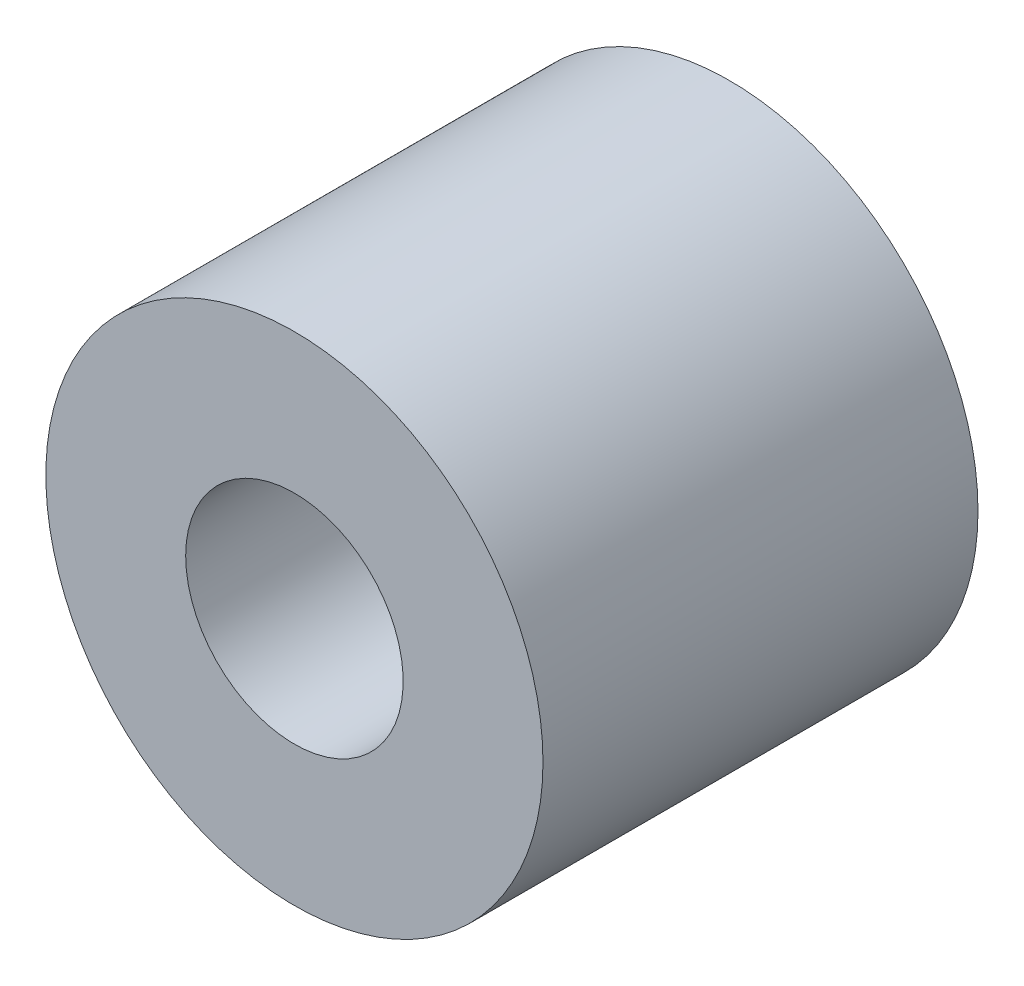
from build123d import *

# Parameters (mm, degrees)
ESBO_O1_R                = 4
RESSALTO_EXTRUS_O1_DEPTH = 7
ESBO_O2_R                = 1.75
CORTE_EXTRUS_O1_DEPTH    = 7


with BuildPart() as part:
    # Esboço1 → Ressalto-extrusão1 (new body)
    with BuildSketch(Plane.XY):
        Circle(ESBO_O1_R)
    extrude(amount=RESSALTO_EXTRUS_O1_DEPTH)

    # Esboço2 → Corte-extrusão1 (cut)
    with BuildSketch(Plane(origin=(0, 0, 0), x_dir=(-1, 0, 0), z_dir=(0, 0, -1))):
        Circle(ESBO_O2_R)
    extrude(amount=-CORTE_EXTRUS_O1_DEPTH, mode=Mode.SUBTRACT)


solid = part.part
